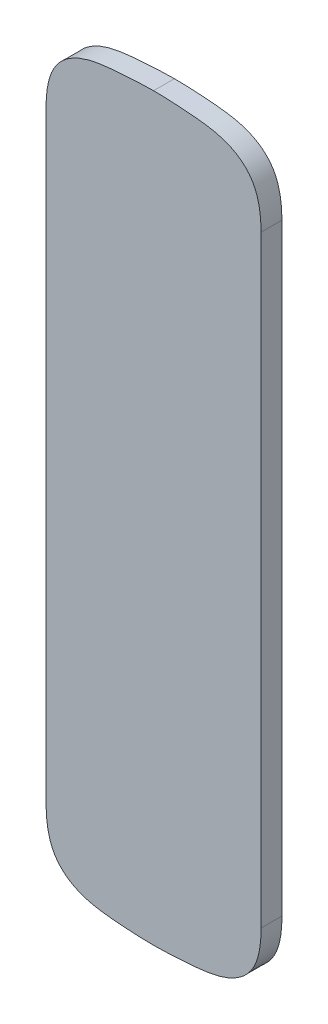
from build123d import *

# Parameters (mm, degrees)
EXTRUDE_1_DEPTH = 1


with BuildPart() as part:
    # 草图1 → 凸台-拉伸1 (new body)
    with BuildSketch(Plane.XY):
        with BuildLine():
            Line((-5.156513066, -23.395653078), (-5.156513076, -52.29634699))
            add(Edge.make_bspline(
                [(-5.156513076, -52.29634699), (-5.156513076, -52.592023575), (-5.121946258, -53.18119242), (-4.883623314, -54.063457093), (-4.345616159, -54.753929213), (-3.309929308, -55.353177735), (-2.096186503, -55.489977412), (-1.054536008, -55.5595988), (-0.477806475, -55.587346335), (-0.156548342, -55.59289984), (-6.7e-08, -55.592882672)],
                knots=[0, 0, 0, 0, 0.125000173, 0.250000346, 0.375000519, 0.500000692, 0.750001038, 0.875001211, 0.937501298, 1.000001384, 1.000001384, 1.000001384, 1.000001384], degree=3))
            add(Edge.make_bspline(
                [(-6.7e-08, -55.592882672), (0.156548209, -55.59289984), (0.477806342, -55.587346335), (1.054535874, -55.5595988), (2.09618637, -55.489977413), (3.309929175, -55.353177737), (4.345616026, -54.753929216), (4.883623182, -54.063457096), (5.121946126, -53.181192423), (5.156512945, -52.592023578), (5.156512945, -52.296346994)],
                knots=[-1.384e-06, -1.384e-06, -1.384e-06, -1.384e-06, 0.062498702, 0.124998789, 0.249998962, 0.499999308, 0.624999481, 0.749999654, 0.874999827, 1, 1, 1, 1], degree=3))
            Line((5.156512945, -52.296346994), (5.156512955, -23.395653081))
            add(Edge.make_bspline(
                [(5.156512955, -23.395653081), (5.156512955, -23.099976497), (5.121946137, -22.510807652), (4.883623193, -21.628542979), (4.345616038, -20.938070858), (3.309929187, -20.338822336), (2.096186382, -20.20202266), (1.054535887, -20.132401272), (0.477806354, -20.104653737), (0.156548221, -20.099100231), (-5.4e-08, -20.0991174)],
                knots=[0, 0, 0, 0, 0.125000173, 0.250000346, 0.375000519, 0.500000692, 0.750001038, 0.875001211, 0.937501298, 1.000001384, 1.000001384, 1.000001384, 1.000001384], degree=3))
            add(Edge.make_bspline(
                [(-5.4e-08, -20.0991174), (-0.15654833, -20.099100231), (-0.477806463, -20.104653736), (-1.054535995, -20.132401271), (-2.096186491, -20.202022658), (-3.309929296, -20.338822334), (-4.345616147, -20.938070855), (-4.883623303, -21.628542975), (-5.121946247, -22.510807648), (-5.156513066, -23.099976493), (-5.156513066, -23.395653078)],
                knots=[-1.384e-06, -1.384e-06, -1.384e-06, -1.384e-06, 0.062498702, 0.124998789, 0.249998962, 0.499999308, 0.624999481, 0.749999654, 0.874999827, 1, 1, 1, 1], degree=3))
        make_face()
    extrude(amount=EXTRUDE_1_DEPTH)


solid = part.part
